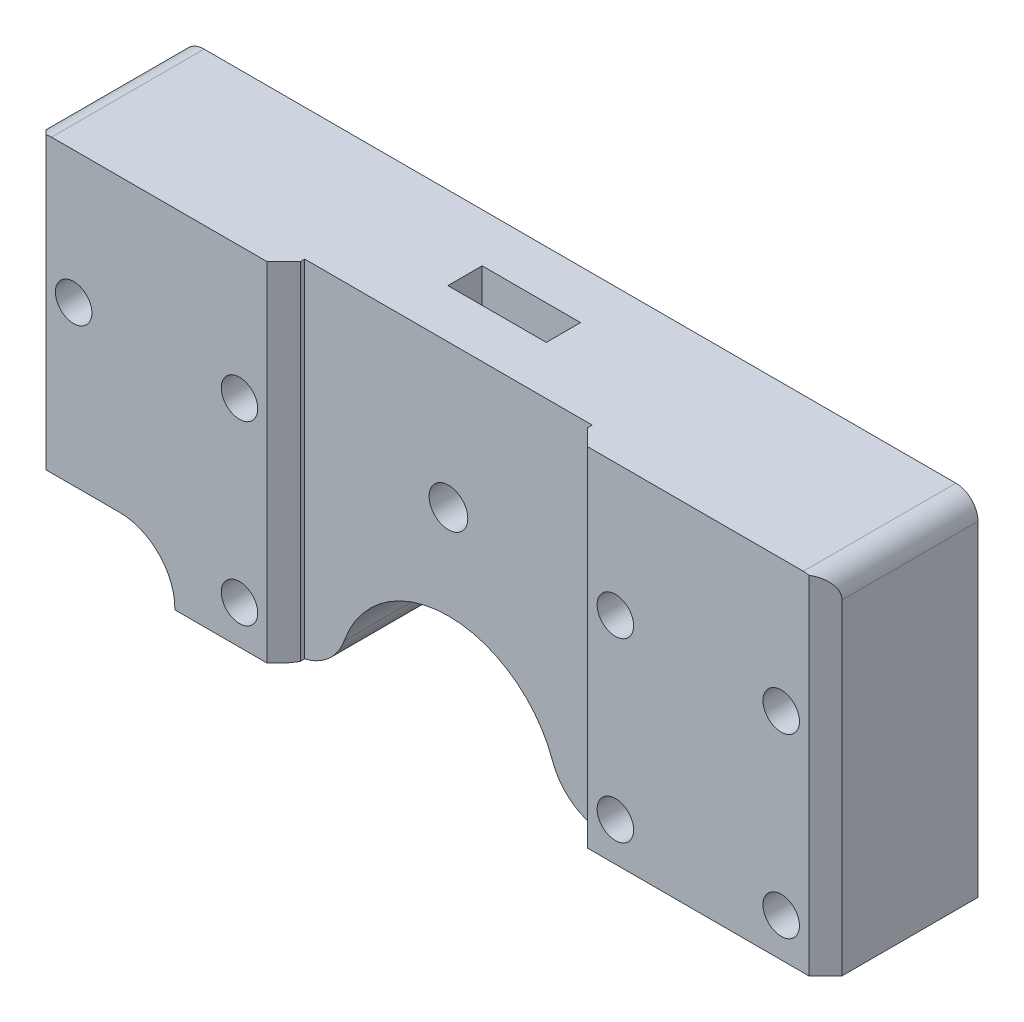
from build123d import *

# Parameters (mm, degrees)
CROQUIS1_W                  = 72
CROQUIS1_H                  = 35.8
SALIENTE_EXTRUIR1_DEPTH     = 23
CORTAR_EXTRUIR2_DEPTH       = 2.8
CROQUIS3_W                  = 5.9
CROQUIS3_H                  = 3.1
CORTAR_EXTRUIR3_DEPTH       = 7.91
SALIENTE_EXTRUIR3_DEPTH     = 3.1
CROQUIS7_W                  = 72
CROQUIS7_H                  = 22
CORTAR_EXTRUIR6_DEPTH       = 37.91
CORTAR_EXTRUIR8_DEPTH       = 15
CORTAR_EXTRUIR8_DEPTH_BACK  = 15
CROQUIS9_R                  = 1.75
CROQUIS11_R                 = 10
CORTAR_EXTRUIR10_DEPTH      = 10
REDONDEO1_R                 = 5
CROQUIS12_W                 = 72
CROQUIS12_H                 = 13.8
CROQUIS12_W_2               = 5.9
CROQUIS12_H_2               = 3.1
SALIENTE_EXTRUIR4_DEPTH     = 3.5
CROQUIS13_R                 = 1.65
CORTAR_EXTRUIR11_DEPTH      = 33.5
CORTAR_EXTRUIR12_DEPTH      = 33.5
CORTAR_EXTRUIR12_DEPTH_BACK = 3
CROQUIS14_R                 = 2.85
CROQUIS15_W                 = 26
CROQUIS15_H                 = 1.9
CORTAR_EXTRUIR13_DEPTH      = 43
CHAFL_N1_SIZE               = 1.5
CHAFL_N2_SIZE               = 1.5
CROQUIS16_W                 = 13.15
CROQUIS16_H                 = 5.14
CORTAR_EXTRUIR14_DEPTH      = 20
REDONDEO3_R                 = 5
CROQUIS17_W                 = 8.9
CROQUIS17_H                 = 3.1
SALIENTE_EXTRUIR5_DEPTH     = 4.95
REDONDEO4_R                 = 2


with BuildPart() as part:
    # Croquis1 → Saliente-Extruir1 (new body)
    with BuildSketch(Plane(origin=(0, 0, 0), x_dir=(1, 0, 0), z_dir=(0, 1, 0))):
        with Locations((36, 17.9)):
            Rectangle(CROQUIS1_W, CROQUIS1_H)
    extrude(amount=SALIENTE_EXTRUIR1_DEPTH)

    # Croquis2 → Cortar-Extruir2 (cut)
    with BuildSketch(Plane(origin=(0, 0, -35.8), x_dir=(-1, 0, 0), z_dir=(0, 0, -1))):
        Polygon((-69.4, 20), (-47, 20), (-47, 23), (-25, 23), (-25, 20), (-2.6, 20), (-2.6, -5), (-69.4, -5), align=None)
    extrude(amount=-CORTAR_EXTRUIR2_DEPTH, mode=Mode.SUBTRACT)

    # Croquis3 → Cortar-Extruir3 (cut)
    with BuildSketch(Plane(origin=(0, 23, 0), x_dir=(1, 0, 0), z_dir=(0, 1, 0))):
        with Locations((36, 29.85)):
            Rectangle(CROQUIS3_W, CROQUIS3_H)
    extrude(amount=-CORTAR_EXTRUIR3_DEPTH, mode=Mode.SUBTRACT)

    # Croquis4 → Saliente-Extruir3 (add)
    with BuildSketch(Plane(origin=(0, 0, -28.3), x_dir=(-1, 0, 0), z_dir=(0, 0, -1))):
        Polygon((-33.05, 16.793183294), (-36, 15.09), (-33.05, 15.09), align=None)
        Polygon((-36, 15.09), (-38.95, 16.793183294), (-38.95, 15.09), align=None)
    extrude(amount=SALIENTE_EXTRUIR3_DEPTH)

    # Croquis7 → Cortar-Extruir6 (cut)
    with BuildSketch(Plane(origin=(0, 23, 0), x_dir=(1, 0, 0), z_dir=(0, 1, 0))):
        with Locations((36, 11)):
            Rectangle(CROQUIS7_W, CROQUIS7_H)
    extrude(amount=-CORTAR_EXTRUIR6_DEPTH, mode=Mode.SUBTRACT)

    # Croquis9 → Cortar-Extruir8 (cut, two sides: drawn at the far end of the back side and taken through both)
    with BuildSketch(Plane(origin=(0, 0, -28.3), x_dir=(-1, 0, 0), z_dir=(0, 0, -1)).offset(-CORTAR_EXTRUIR8_DEPTH_BACK)):
        with Locations(Location((-36, 18.496366588, 0), (0, 0, 180))):
            Circle(CROQUIS9_R)
    extrude(amount=CORTAR_EXTRUIR8_DEPTH + CORTAR_EXTRUIR8_DEPTH_BACK, mode=Mode.SUBTRACT)

    # Croquis11 → Cortar-Extruir10 (cut)
    with BuildSketch(Plane(origin=(0, 0, -33), x_dir=(-1, 0, 0), z_dir=(0, 0, -1))):
        with Locations((-36, 0)):
            Circle(CROQUIS11_R)
    extrude(amount=-CORTAR_EXTRUIR10_DEPTH, mode=Mode.SUBTRACT)

    # Redondeo1
    redondeo1_edges = [part.edges().sort_by_distance(p)[0] for p in [
        (26, 0, -28),
        (46, 0, -28),
    ]]
    fillet(redondeo1_edges, radius=REDONDEO1_R)

    # Croquis12 → Saliente-Extruir4 (add)
    with BuildSketch(Plane(origin=(0, 23, 0), x_dir=(1, 0, 0), z_dir=(0, 1, 0))):
        with Locations((36, 28.9)):
            Rectangle(CROQUIS12_W, CROQUIS12_H)
        with Locations((36, 29.85)):
            Rectangle(CROQUIS12_W_2, CROQUIS12_H_2, mode=Mode.SUBTRACT)
    extrude(amount=SALIENTE_EXTRUIR4_DEPTH)

    # Croquis13 → Cortar-Extruir11 (cut)
    with BuildSketch(Plane.XY.offset(-22)):
        with Locations((19, 3.5)):
            Circle(CROQUIS13_R)
        with Locations((19, 19.5)):
            Circle(CROQUIS13_R)
        with Locations((4, 19.5)):
            Circle(CROQUIS13_R)
        with Locations((53, 3.5)):
            Circle(CROQUIS13_R)
        with Locations(Location((68, 3.5, 0), (0, 0, 31.9527464))):
            Circle(CROQUIS13_R)
        with Locations(Location((68, 19.5, 0), (0, 0, 328.0472536))):
            Circle(CROQUIS13_R)
        with Locations(Location((53, 19.5, 0), (0, 0, 17.639701394))):
            Circle(CROQUIS13_R)
    extrude(amount=-CORTAR_EXTRUIR11_DEPTH, mode=Mode.SUBTRACT)

    # Croquis14 → Cortar-Extruir12 (cut, two sides: drawn at the far end of the back side and taken through both)
    with BuildSketch(Plane(origin=(0, 0, -33), x_dir=(-1, 0, 0), z_dir=(0, 0, -1)).offset(-CORTAR_EXTRUIR12_DEPTH_BACK)):
        with Locations(Location((-53, 19.5, 0), (0, 0, 169.895817284))):
            Circle(CROQUIS14_R)
        with Locations(Location((-53, 3.5, 0), (0, 0, 180))):
            Circle(CROQUIS14_R)
        with Locations(Location((-68, 3.5, 0), (0, 0, 240.578668933))):
            Circle(CROQUIS14_R)
        with Locations(Location((-68, 19.5, 0), (0, 0, 240.578668933))):
            Circle(CROQUIS14_R)
        with Locations(Location((-19, 3.5, 0), (0, 0, 180))):
            Circle(CROQUIS14_R)
        with Locations(Location((-19, 19.5, 0), (0, 0, 169.895817284))):
            Circle(CROQUIS14_R)
        with Locations(Location((-4, 19.5, 0), (0, 0, 169.895817284))):
            Circle(CROQUIS14_R)
    extrude(amount=CORTAR_EXTRUIR12_DEPTH + CORTAR_EXTRUIR12_DEPTH_BACK, mode=Mode.SUBTRACT)

    # Croquis15 → Cortar-Extruir13 (cut)
    with BuildSketch(Plane(origin=(0, 26.5, 0), x_dir=(1, 0, 0), z_dir=(0, 1, 0))):
        with Locations((36, 22.95)):
            Rectangle(CROQUIS15_W, CROQUIS15_H)
    extrude(amount=-CORTAR_EXTRUIR13_DEPTH, mode=Mode.SUBTRACT)

    # Chaflán1
    chafl_n1_edges = [part.edges().sort_by_distance(p)[0] for p in [
        (49, 13.25, -22),
        (23, 13.25, -22),
        (72, 13.25, -22),
        (0, 13.25, -22),
    ]]
    chamfer(chafl_n1_edges, length=CHAFL_N1_SIZE)

    # Chaflán2
    chafl_n2_edges = [part.edges().sort_by_distance(p)[0] for p in [
        (33.05, 26.5, -29.85),
        (38.95, 26.5, -29.85),
    ]]
    chamfer(chafl_n2_edges, length=CHAFL_N2_SIZE)

    # Croquis16 → Cortar-Extruir14 (cut)
    with BuildSketch(Plane(origin=(0, 0, -35.8), x_dir=(-1, 0, 0), z_dir=(0, 0, -1))):
        with Locations((-6.575, 2.57)):
            Rectangle(CROQUIS16_W, CROQUIS16_H)
    extrude(amount=-CORTAR_EXTRUIR14_DEPTH, mode=Mode.SUBTRACT)

    # Redondeo3
    redondeo3_edges = [part.edges().sort_by_distance(p)[0] for p in [
        (13.15, 5.14, -27.5),
    ]]
    fillet(redondeo3_edges, radius=REDONDEO3_R)

    # Croquis17 → Saliente-Extruir5 (add)
    with BuildSketch(Plane(origin=(0, 26.5, 0), x_dir=(1, 0, 0), z_dir=(0, 1, 0))):
        Polygon((70.5, 22), (72, 23.5), (72, 35.8), (0, 35.8), (0, 23.5), (1.5, 22), (21.5, 22), (23, 23.5), (23, 23.9), (49, 23.9), (49, 23.5), (50.5, 22), align=None)
        with Locations((36, 29.85)):
            Rectangle(CROQUIS17_W, CROQUIS17_H, mode=Mode.SUBTRACT)
    extrude(amount=SALIENTE_EXTRUIR5_DEPTH)

    # Redondeo4
    redondeo4_edges = [part.edges().sort_by_distance(p)[0] for p in [
        (72, 31.45, -29.65),
        (0, 31.45, -29.65),
    ]]
    fillet(redondeo4_edges, radius=REDONDEO4_R)


solid = part.part
